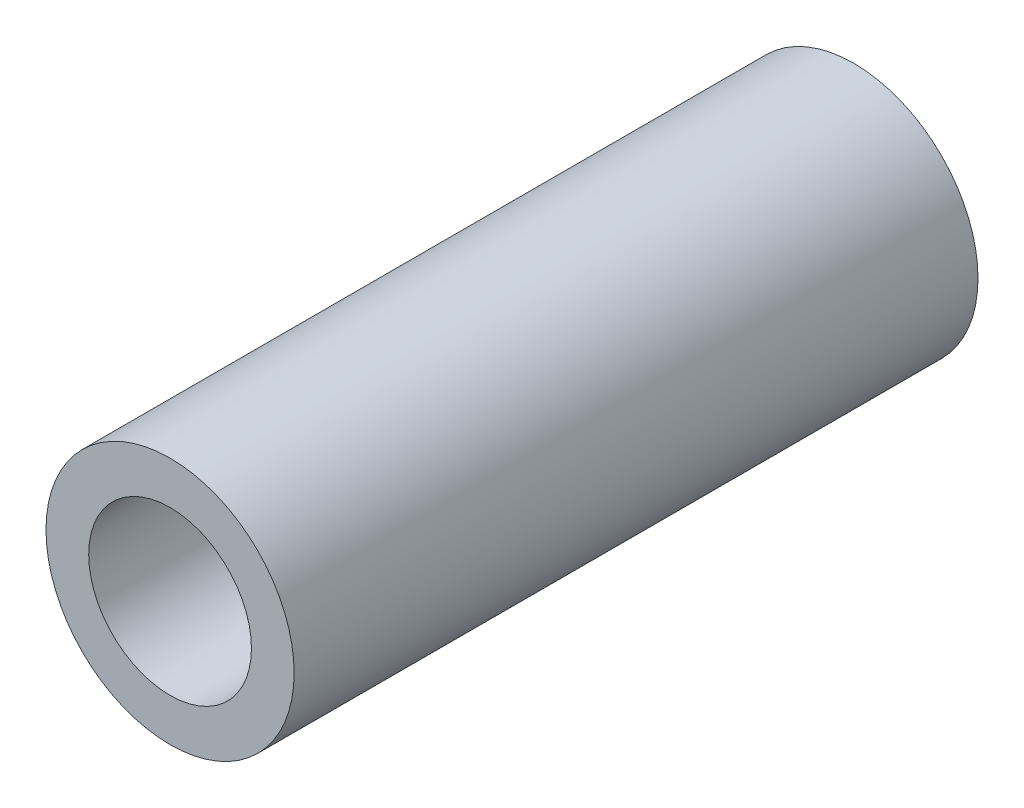
from build123d import *

# Parameters (mm, degrees)
SKETCH1_R           = 6.35
SKETCH1_R_2         = 4.165
BOSS_EXTRUDE1_DEPTH = 35


with BuildPart() as part:
    # Sketch1 → Boss-Extrude1 (new body)
    with BuildSketch(Plane.XY):
        Circle(SKETCH1_R)
        Circle(SKETCH1_R_2, mode=Mode.SUBTRACT)
    extrude(amount=BOSS_EXTRUDE1_DEPTH)


solid = part.part
